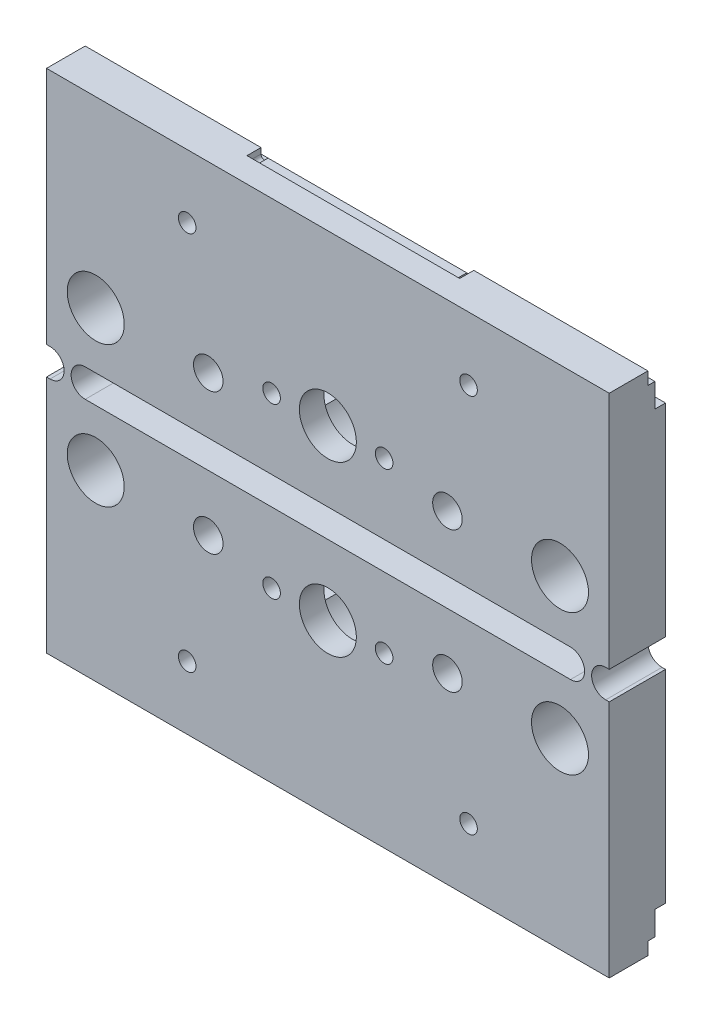
from build123d import *

# Parameters (mm, degrees)
SKETCH_2_W           = 80
SKETCH_2_H           = 34
SKETCH_2_R           = 4.05
EXTRUDE_1_DEPTH      = 8
CUT_EXTRUDE_2_DEPTH  = 88.292611371
CUT_EXTRUDE_12_DEPTH = 4.5
SKETCH_20_R          = 6.25
CUT_EXTRUDE_13_DEPTH = 4.5
CUT_EXTRUDE_11_DEPTH = 2
HOLE_WIZARD_M5_1_D   = 4.2
HOLE_WIZARD_M3_1_D   = 2.5
HOLE_WIZARD_M3_2_D   = 2.5
EXTRUDE_2_DEPTH      = 8


with BuildPart() as part:
    # 草图2 → 凸台-拉伸1 (new body)
    with BuildSketch(Plane.XY):
        with Locations((40, 17)):
            Rectangle(SKETCH_2_W, SKETCH_2_H)
        with Locations((7, 8)):
            Circle(SKETCH_2_R, mode=Mode.SUBTRACT)
        with Locations((40, 10)):
            Circle(SKETCH_2_R, mode=Mode.SUBTRACT)
        with Locations((73, 8)):
            Circle(SKETCH_2_R, mode=Mode.SUBTRACT)
    extrude_1 = extrude(amount=EXTRUDE_1_DEPTH)

    # 草图4 → 切除-拉伸2 (cut, through all)
    with BuildSketch(Plane(origin=(80, 0, 0), x_dir=(0, 0, -1), z_dir=(1, 0, 0))):
        Polygon((-1.5, 32.2), (-2.5, 32.2), (-2.5, 34), (0, 34), (0, 28.8), (-1.5, 28.8), align=None)
    cut_extrude_2 = extrude(amount=-CUT_EXTRUDE_2_DEPTH, mode=Mode.SUBTRACT)

    # 草图8 → 切除-拉伸12 (cut)
    with BuildSketch(Plane(origin=(0, 0, 0), x_dir=(-1, 0, 0), z_dir=(0, 0, -1))):
        with BuildLine():
            Line((-30.5, 12.85), (-49.5, 12.85))
            ThreePointArc((-49.5, 12.85), (-52.35, 10), (-49.5, 7.15))
            Line((-49.5, 7.15), (-30.5, 7.15))
            ThreePointArc((-30.5, 7.15), (-27.65, 10), (-30.5, 12.85))
        make_face()
    cut_extrude_12 = extrude(amount=-CUT_EXTRUDE_12_DEPTH, mode=Mode.SUBTRACT)

    # 草图20 → 切除-拉伸13 (cut)
    with BuildSketch(Plane(origin=(0, 0, 0), x_dir=(-1, 0, 0), z_dir=(0, 0, -1))):
        with Locations((-40, 10)):
            Circle(SKETCH_20_R)
    cut_extrude_13 = extrude(amount=-CUT_EXTRUDE_13_DEPTH, mode=Mode.SUBTRACT)

    # 草图19 → 切除-拉伸11 (cut)
    with BuildSketch(Plane(origin=(0, 0, 2.5), x_dir=(-1, 0, 0), z_dir=(0, 0, -1))):
        with BuildLine():
            Line((-25, 34), (-55.247938178, 34))
            Line((-55.247938178, 34), (-55.247938178, 33.2))
            ThreePointArc((-55.247938178, 33.2), (-54.747938178, 32.7), (-54.247938178, 33.2))
            Line((-54.247938178, 33.2), (-26, 33.2))
            ThreePointArc((-26, 33.2), (-25.5, 32.7), (-25, 33.2))
            Line((-25, 33.2), (-25, 34))
        make_face()
    cut_extrude_11 = extrude(amount=-CUT_EXTRUDE_11_DEPTH, mode=Mode.SUBTRACT)

    # M5 螺纹孔1 (through all)
    with Locations(Plane(origin=(57, 8, 8), x_dir=(1, 0, 0), z_dir=(0, 0, 1))):
        with Locations((0, 0), (-34, 0)):
            hole_wizard_m5_1 = Hole(HOLE_WIZARD_M5_1_D / 2)

    # M3 螺纹孔1 (through all)
    with Locations(Plane(origin=(48, 10, 8), x_dir=(1, 0, 0), z_dir=(0, 0, 1))):
        with Locations((0, 0), (-16, 0)):
            hole_wizard_m3_1 = Hole(HOLE_WIZARD_M3_1_D / 2)

    # M3 螺纹孔2 (through all)
    with Locations(Plane(origin=(60, 25, 0), x_dir=(-1, 0, 0), z_dir=(0, 0, -1))):
        with Locations((0, 0), (40, 0)):
            hole_wizard_m3_2 = Hole(HOLE_WIZARD_M3_2_D / 2)

    # 草图22 → 凸台-拉伸2 (add)
    with BuildSketch(Plane.XY.offset(8)):
        with BuildLine():
            Line((0.5, -4), (5.5, -4))
            ThreePointArc((5.5, -4), (3.5, -2), (5.5, 0))
            Line((5.5, 0), (0.5, 0))
            ThreePointArc((0.5, 0), (2.5, -2), (0.5, -4))
        make_face()
        with BuildLine():
            Line((79.5, 0), (74.5, 0))
            ThreePointArc((74.5, 0), (76.5, -2), (74.5, -4))
            Line((74.5, -4), (79.5, -4))
            ThreePointArc((79.5, -4), (77.5, -2), (79.5, 0))
        make_face()
    extrude(amount=-EXTRUDE_2_DEPTH)

    # 镜向2: 凸台-拉伸1, 切除-拉伸2, 切除-拉伸12, 切除-拉伸13, 切除-拉伸11, M5 螺纹孔1, M3 螺纹孔1, M3 螺纹孔2 across plane
    add(extrude_1.mirror(Plane(origin=(0, -2, 0), x_dir=(0, 0, 1), z_dir=(0, -1, 0))))
    add(cut_extrude_2.mirror(Plane(origin=(0, -2, 0), x_dir=(0, 0, 1), z_dir=(0, -1, 0))), mode=Mode.SUBTRACT)
    add(cut_extrude_12.mirror(Plane(origin=(0, -2, 0), x_dir=(0, 0, 1), z_dir=(0, -1, 0))), mode=Mode.SUBTRACT)
    add(cut_extrude_13.mirror(Plane(origin=(0, -2, 0), x_dir=(0, 0, 1), z_dir=(0, -1, 0))), mode=Mode.SUBTRACT)
    add(cut_extrude_11.mirror(Plane(origin=(0, -2, 0), x_dir=(0, 0, 1), z_dir=(0, -1, 0))), mode=Mode.SUBTRACT)
    add(hole_wizard_m5_1.mirror(Plane(origin=(0, -2, 0), x_dir=(0, 0, 1), z_dir=(0, -1, 0))), mode=Mode.SUBTRACT)
    add(hole_wizard_m3_1.mirror(Plane(origin=(0, -2, 0), x_dir=(0, 0, 1), z_dir=(0, -1, 0))), mode=Mode.SUBTRACT)
    add(hole_wizard_m3_2.mirror(Plane(origin=(0, -2, 0), x_dir=(0, 0, 1), z_dir=(0, -1, 0))), mode=Mode.SUBTRACT)


solid = part.part
